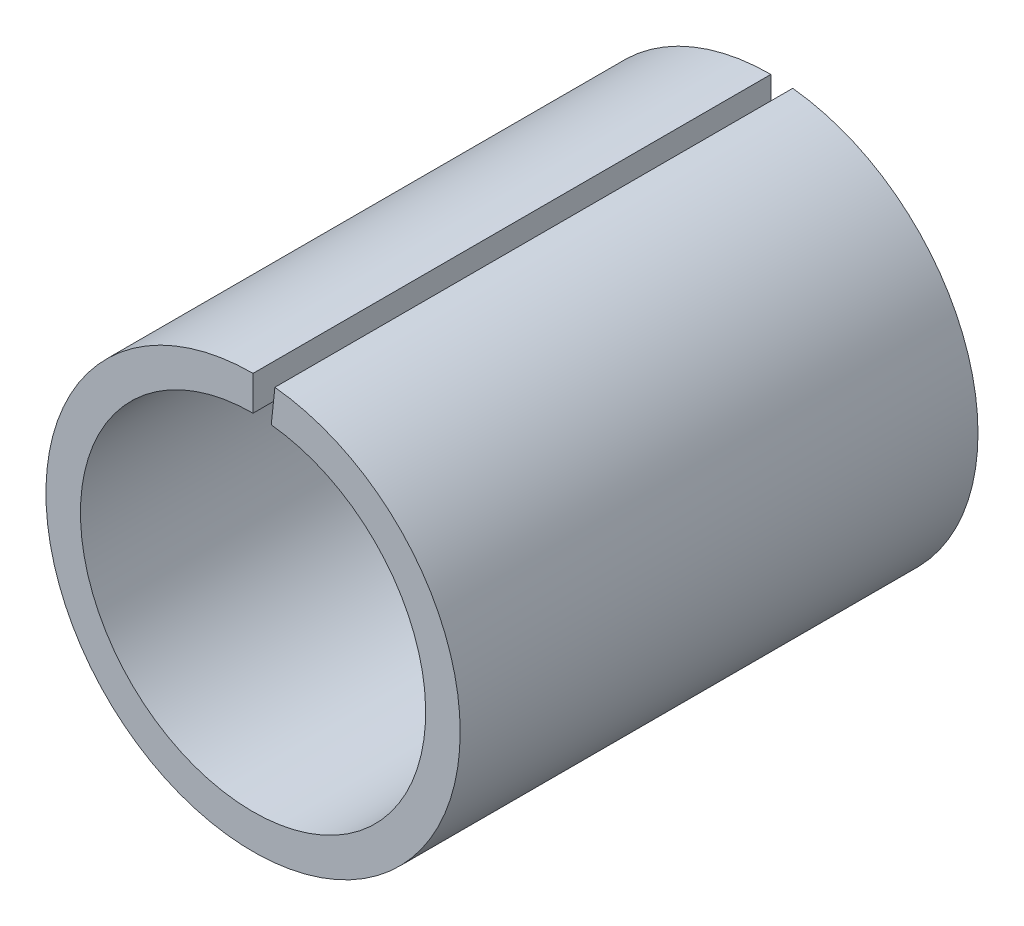
from build123d import *

# Parameters (mm, degrees)
SKETCH_1_R          = 6
SKETCH_1_R_2        = 5
EXTRUDE_1_DEPTH     = 15
CUT_EXTRUDE_1_DEPTH = 100


with BuildPart() as part:
    # 草图1 → 凸台-拉伸1 (new body)
    with BuildSketch(Plane.XY):
        Circle(SKETCH_1_R)
        Circle(SKETCH_1_R_2, mode=Mode.SUBTRACT)
    extrude(amount=EXTRUDE_1_DEPTH)

    # 草图2 → 切除-拉伸1 (cut)
    with BuildSketch(Plane.XY.offset(15)):
        Polygon((0, 0), (0, 6), (0.817779961, 7.717234405), align=None)
    extrude(amount=-CUT_EXTRUDE_1_DEPTH, mode=Mode.SUBTRACT)


solid = part.part
